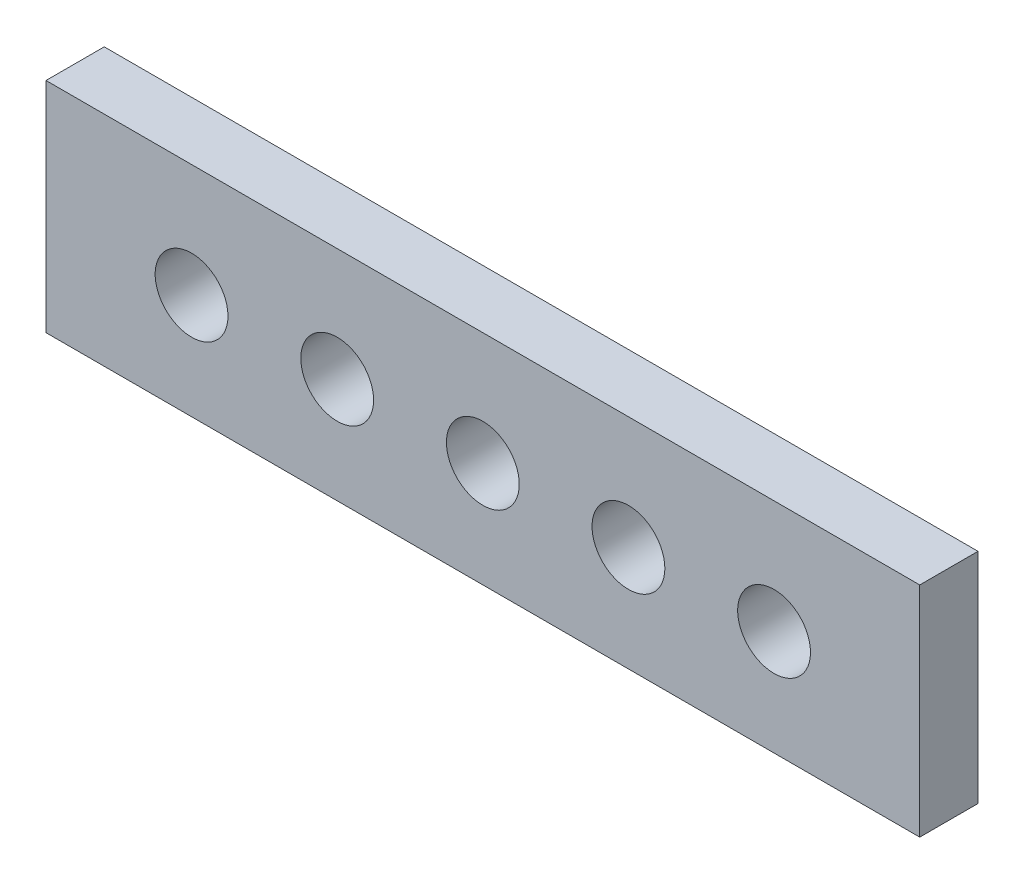
from build123d import *

# Parameters (mm, degrees)
SKETCH1_W           = 152.4
SKETCH1_H           = 38.1
SKETCH1_R           = 6.35
BOSS_EXTRUDE1_DEPTH = 10.16


with BuildPart() as part:
    # Sketch1 → Boss-Extrude1 (new body)
    with BuildSketch(Plane.XY):
        with Locations((32.505952381, 1.133928571)):
            Rectangle(SKETCH1_W, SKETCH1_H)
        with Locations((-18.303205723, 0.451911108)):
            Circle(SKETCH1_R, mode=Mode.SUBTRACT)
        with Locations((32.496794277, 0.451911108)):
            Circle(SKETCH1_R, mode=Mode.SUBTRACT)
        with Locations((7.096794277, 0.451911108)):
            Circle(SKETCH1_R, mode=Mode.SUBTRACT)
        with Locations((57.896794277, 0.451911108)):
            Circle(SKETCH1_R, mode=Mode.SUBTRACT)
        with Locations((83.296794277, 0.451911108)):
            Circle(SKETCH1_R, mode=Mode.SUBTRACT)
    extrude(amount=BOSS_EXTRUDE1_DEPTH)


solid = part.part
